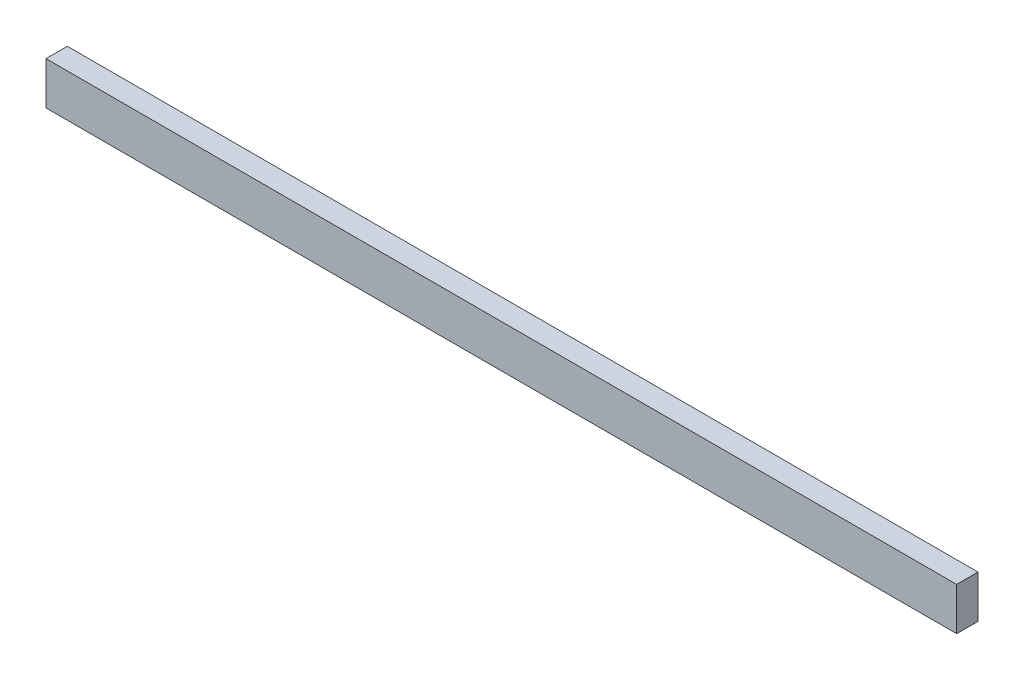
from build123d import *

# Parameters (mm, degrees)
SKETCH1_W           = 1083.14370935
SKETCH1_H           = 50.8
BOSS_EXTRUDE1_DEPTH = 25.4


with BuildPart() as part:
    # Sketch1 → Boss-Extrude1 (new body)
    with BuildSketch(Plane.XY):
        with Locations((8.249466657, 4.949679994)):
            Rectangle(SKETCH1_W, SKETCH1_H)
    extrude(amount=BOSS_EXTRUDE1_DEPTH)


solid = part.part
